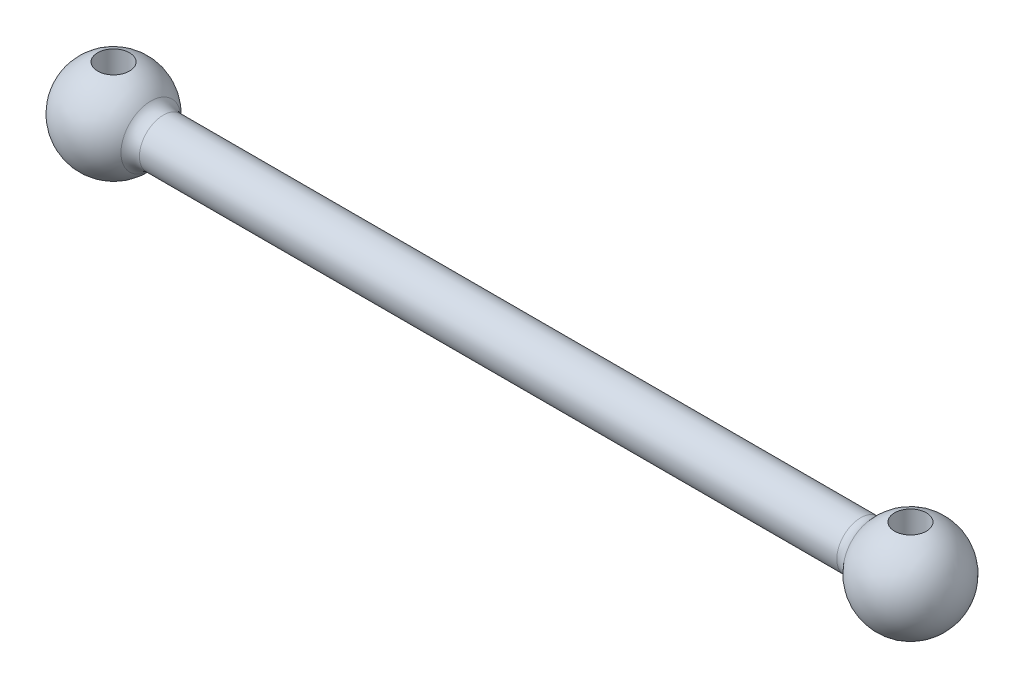
from build123d import *

# Parameters (mm, degrees)
SKETCH1_W          = 23
SKETCH1_H          = 1.5
SKETCH2_R          = 1
CUT_EXTRUDE1_DEPTH = 29.792360098
FILLET1_R          = 1
FILLET2_R          = 1


with BuildPart() as part:
    # Sketch1 → Revolve2 (revolve)
    with BuildSketch(Plane.XY, mode=Mode.PRIVATE) as revolve2_sk:
        with BuildLine():
            Line((23, 1.5), (23, 0))
            Line((23, 0), (28, 0))
            ThreePointArc((28, 0), (25.776457135, 2.897777479), (22.401923789, 1.5))
            Line((22.401923789, 1.5), (23, 1.5))
        make_face()
        with Locations((11.5, 0.75)):
            Rectangle(SKETCH1_W, SKETCH1_H)
    revolve2 = revolve(revolve2_sk.sketch.rotate(Axis((0, 0, 0), (1, 0, 0)), 90), axis=Axis((0, 0, 0), (1, 0, 0)))

    # Sketch2 → Cut-Extrude1 (cut, through all)
    with BuildSketch(Plane(origin=(0, 3, 0), x_dir=(1, 0, 0), z_dir=(0, 1, 0))):
        with Locations(Location((25, 0, 0), (0, 0, 270))):
            Circle(SKETCH2_R)
    cut_extrude1 = extrude(amount=-CUT_EXTRUDE1_DEPTH, mode=Mode.SUBTRACT)

    # Mirror1: Revolve2, Cut-Extrude1 across plane
    add(revolve2.mirror(Plane.ZY))
    add(cut_extrude1.mirror(Plane.ZY), mode=Mode.SUBTRACT)

    # Fillet1
    fillet1_edges = [part.edges().sort_by_distance(p)[0] for p in [
        (22.401923789, 0, -1.5),
    ]]
    fillet(fillet1_edges, radius=FILLET1_R)

    # Fillet2
    fillet2_edges = [part.edges().sort_by_distance(p)[0] for p in [
        (-22.401923789, 0, -1.5),
    ]]
    fillet(fillet2_edges, radius=FILLET2_R)


solid = part.part
